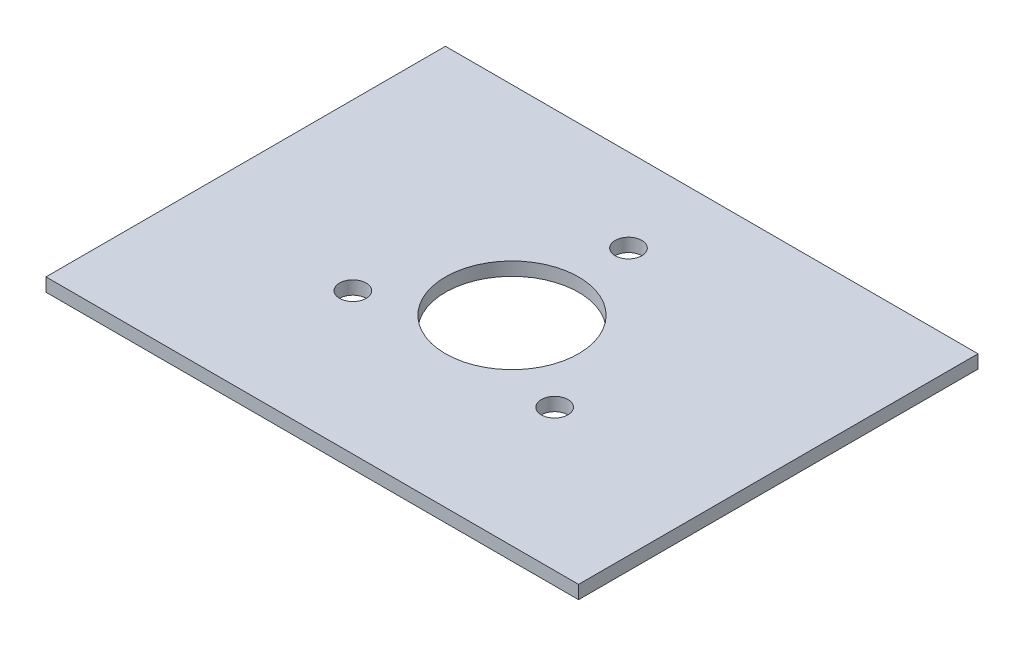
from build123d import *

# Parameters (mm, degrees)
ESQUISSE1_W        = 80
ESQUISSE1_H        = 60
ESQUISSE1_R        = 2
ESQUISSE1_R_2      = 10
BOSS_EXTRU_1_DEPTH = 2


with BuildPart() as part:
    # Esquisse1 → Boss.-Extru.1 (new body)
    with BuildSketch(Plane(origin=(0, 0, 0), x_dir=(1, 0, 0), z_dir=(0, 1, 0))):
        Rectangle(ESQUISSE1_W, ESQUISSE1_H)
        with Locations(Location((15.155444566, -8.75, 0), (0, 0, 270))):
            Circle(ESQUISSE1_R, mode=Mode.SUBTRACT)
        with Locations(Location((-15.155444566, -8.75, 0), (0, 0, 270))):
            Circle(ESQUISSE1_R, mode=Mode.SUBTRACT)
        with Locations(Location((0, 17.5, 0), (0, 0, 270))):
            Circle(ESQUISSE1_R, mode=Mode.SUBTRACT)
        with Locations(Location((0, 0, 0), (0, 0, 270))):
            Circle(ESQUISSE1_R_2, mode=Mode.SUBTRACT)
    extrude(amount=BOSS_EXTRU_1_DEPTH)


solid = part.part
